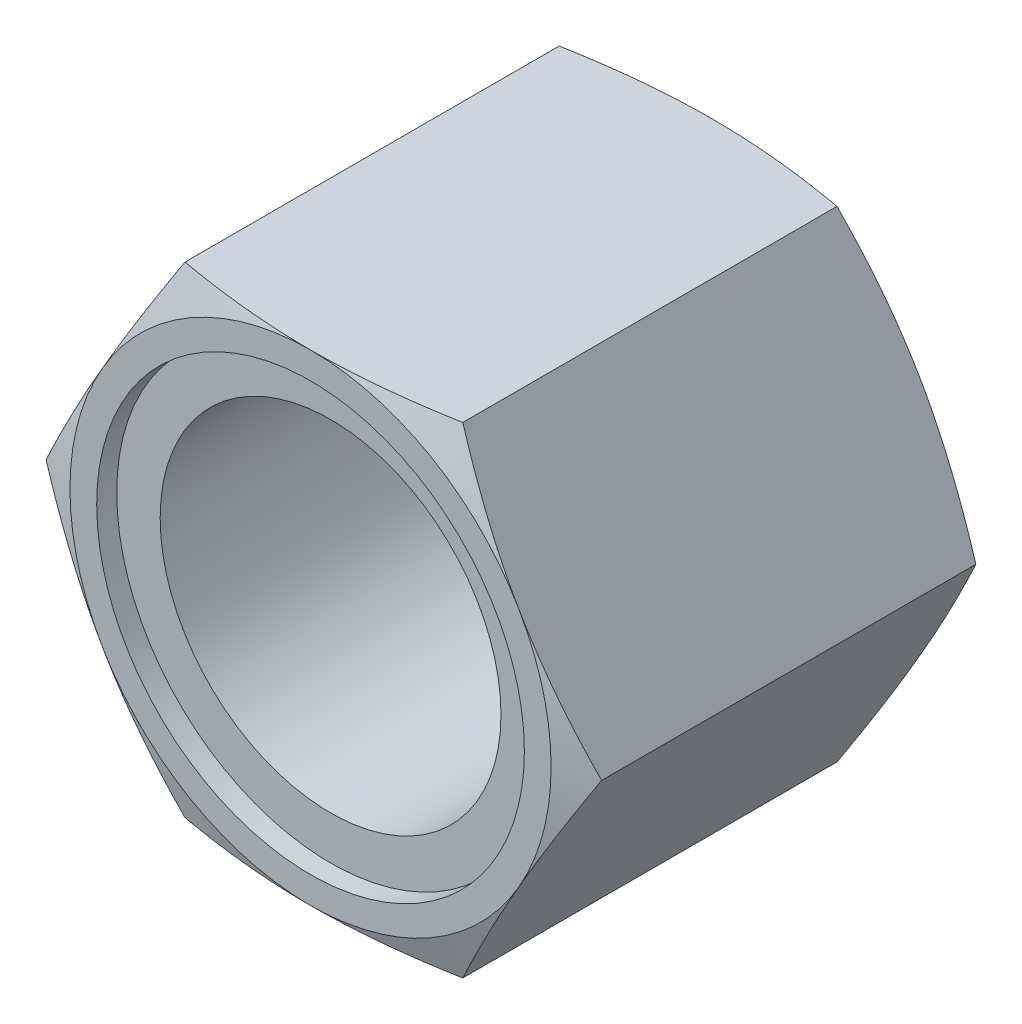
from build123d import *

# Parameters (mm, degrees)
EXTRUDE_1_DEPTH     = 30
SKETCH_2_R          = 12.75
CUT_EXTRUDE_1_DEPTH = 25
SKETCH_3_R          = 13.5
CUT_EXTRUDE_2_DEPTH = 4
SKETCH_4_R          = 16
CUT_EXTRUDE_3_DEPTH = 1.5


with BuildPart() as part:
    # Эскиз1 → Вытянуть1 (new body)
    with BuildSketch(Plane.XY):
        Polygon((10.392304845, 18), (-10.392304845, 18), (-20.784609691, 0), (-10.392304845, -18), (10.392304845, -18), (20.784609691, 0), align=None)
    extrude(amount=EXTRUDE_1_DEPTH)

    # Эскиз2 → Вырез-Вытянуть1 (cut)
    with BuildSketch(Plane.XY.offset(30)):
        Circle(SKETCH_2_R)
    extrude(amount=-CUT_EXTRUDE_1_DEPTH, mode=Mode.SUBTRACT)

    # Эскиз3 → Вырез-Вытянуть2 (cut)
    with BuildSketch(Plane.XY.offset(5)):
        Circle(SKETCH_3_R)
    extrude(amount=CUT_EXTRUDE_2_DEPTH, mode=Mode.SUBTRACT)

    # Эскиз4 → Вырез-Вытянуть3 (cut)
    with BuildSketch(Plane.XY.offset(30)):
        Circle(SKETCH_4_R)
    extrude(amount=-CUT_EXTRUDE_3_DEPTH, mode=Mode.SUBTRACT)

    # Эскиз5 → Вырез-Повернуть1 (revolve, cut)
    with BuildSketch(Plane(origin=(0, 0, 0), x_dir=(1, 0, 0), z_dir=(0, 1, 0))):
        Polygon((20.784609691, -30), (20.784609691, -29), (18, -30), align=None)
        Polygon((20.784609691, 0), (18, 0), (20.784609691, -1), align=None)
    revolve(axis=Axis((0, 0, 28.5), (0, 0, -1)), mode=Mode.SUBTRACT)


solid = part.part
